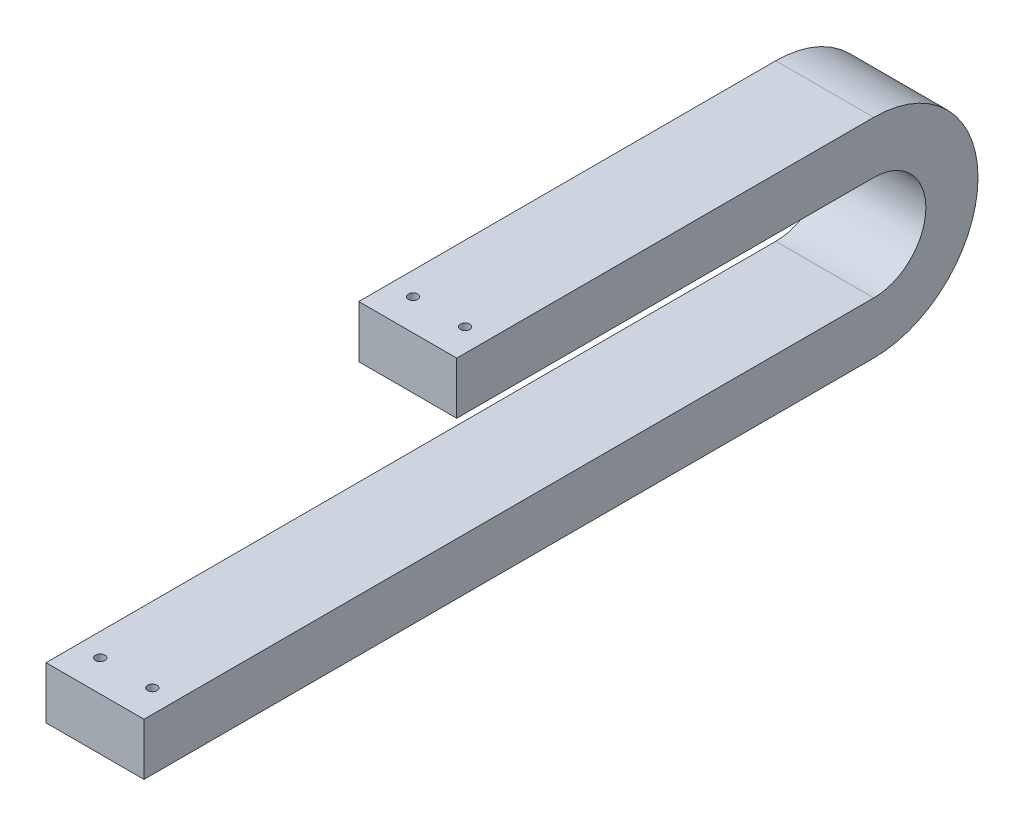
from build123d import *

# Parameters (mm, degrees)
EXTRUDE_1_DEPTH     = 47
SKETCH_2_R          = 2.25
CUT_EXTRUDE_1_DEPTH = 90
SKETCH_3_R          = 2.25
CUT_EXTRUDE_2_DEPTH = 40


with BuildPart() as part:
    # 草图1 → 凸台-拉伸1 (new body)
    with BuildSketch(Plane(origin=(0, 0, 0), x_dir=(0, 0, -1), z_dir=(1, 0, 0))):
        with BuildLine():
            Line((0, 0), (350, 0))
            ThreePointArc((350, 0), (375, 25), (350, 50))
            Line((350, 50), (150, 50))
            Line((150, 50), (150, 75))
            Line((150, 75), (350, 75))
            ThreePointArc((350, 75), (400, 25), (350, -25))
            Line((350, -25), (0, -25))
            Line((0, -25), (0, 0))
        make_face()
    extrude(amount=EXTRUDE_1_DEPTH)

    # 草图2 → 切除-拉伸1 (cut)
    with BuildSketch(Plane(origin=(0, 0, 0), x_dir=(1, 0, 0), z_dir=(0, 1, 0))):
        with Locations(Location((36, 15, 0), (0, 0, 270))):
            Circle(SKETCH_2_R)
        with Locations(Location((11, 15, 0), (0, 0, 270))):
            Circle(SKETCH_2_R)
    extrude(amount=-CUT_EXTRUDE_1_DEPTH, mode=Mode.SUBTRACT)

    # 草图3 → 切除-拉伸2 (cut)
    with BuildSketch(Plane(origin=(0, 75, 0), x_dir=(1, 0, 0), z_dir=(0, 1, 0))):
        with Locations(Location((11, 165, 0), (0, 0, 270))):
            Circle(SKETCH_3_R)
        with Locations(Location((36, 165, 0), (0, 0, 270))):
            Circle(SKETCH_3_R)
    extrude(amount=-CUT_EXTRUDE_2_DEPTH, mode=Mode.SUBTRACT)


solid = part.part
